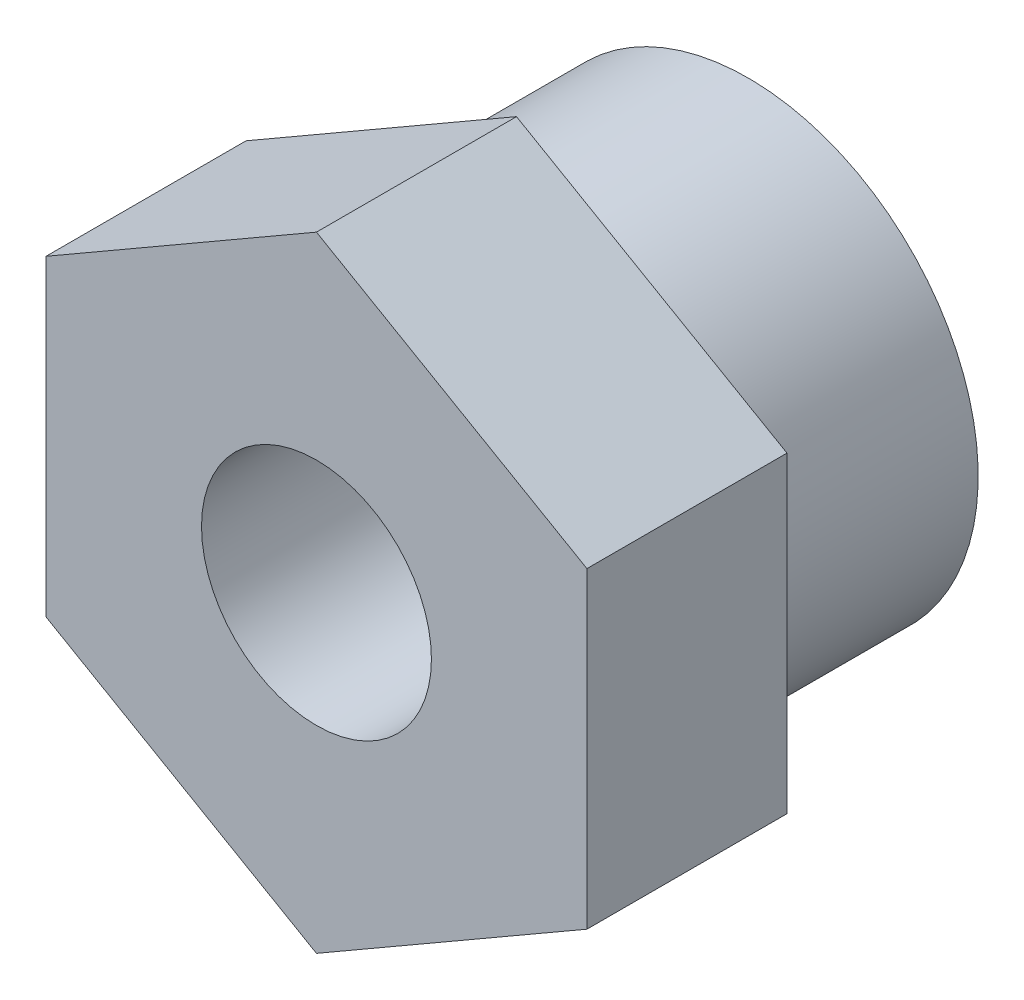
from build123d import *

# Parameters (mm, degrees)
SCHIZZO1_R                   = 17.25
ESTRUSIONE_ESTRUSIONE1_DEPTH = 23.85
TAGLIO_ESTRUSIONE1_START     = -11.05
TAGLIO_ESTRUSIONE1_DEPTH     = 11.05
FORO_25_5_12_7_1_D           = 12.7
SCHIZZO5_R                   = 17.25
SCHIZZO5_R_2                 = 12.7
TAGLIO_ESTRUSIONE2_DEPTH     = 12.8


with BuildPart() as part:
    # Schizzo1 → Estrusione-Estrusione1 (new body)
    with BuildSketch(Plane.XY):
        Circle(SCHIZZO1_R)
    extrude(amount=ESTRUSIONE_ESTRUSIONE1_DEPTH)

    # Schizzo2 → Taglio-Estrusione1 (cut)
    with BuildSketch(Plane.XY.offset(23.85).offset(TAGLIO_ESTRUSIONE1_START)):
        with BuildLine():
            Line((-14.938938215, 8.625), (0, 17.25))
            ThreePointArc((0, 17.25), (-8.625, 14.938938215), (-14.938938215, 8.625))
        make_face()
        with BuildLine():
            Line((-14.938938215, -8.625), (-14.938938215, 8.625))
            ThreePointArc((-14.938938215, 8.625), (-17.25, 0), (-14.938938215, -8.625))
        make_face()
        with BuildLine():
            Line((0, -17.25), (-14.938938215, -8.625))
            ThreePointArc((-14.938938215, -8.625), (-8.625, -14.938938215), (0, -17.25))
        make_face()
        with BuildLine():
            ThreePointArc((0, -17.25), (8.625, -14.938938215), (14.938938215, -8.625))
            Line((14.938938215, -8.625), (0, -17.25))
        make_face()
        with BuildLine():
            ThreePointArc((17.25, 0), (16.662220503, 4.464628528), (14.938938215, 8.625))
            Line((14.938938215, 8.625), (14.938938215, -8.625))
            ThreePointArc((14.938938215, -8.625), (16.662220503, -4.464628528), (17.25, 0))
        make_face()
        with BuildLine():
            ThreePointArc((14.938938215, 8.625), (8.625, 14.938938215), (0, 17.25))
            Line((0, 17.25), (14.938938215, 8.625))
        make_face()
    extrude(amount=TAGLIO_ESTRUSIONE1_DEPTH, mode=Mode.SUBTRACT)

    # Foro Ø25.5 (12.7)-1 (through all)
    with Locations(Plane.XY.offset(23.85)):
        with Locations((0, 0)):
            Hole(FORO_25_5_12_7_1_D / 2)

    # Schizzo5 → Taglio-Estrusione2 (cut)
    with BuildSketch(Plane(origin=(0, 0, 0), x_dir=(-1, 0, 0), z_dir=(0, 0, -1))):
        Circle(SCHIZZO5_R)
        Circle(SCHIZZO5_R_2, mode=Mode.SUBTRACT)
    extrude(amount=-TAGLIO_ESTRUSIONE2_DEPTH, mode=Mode.SUBTRACT)


solid = part.part
